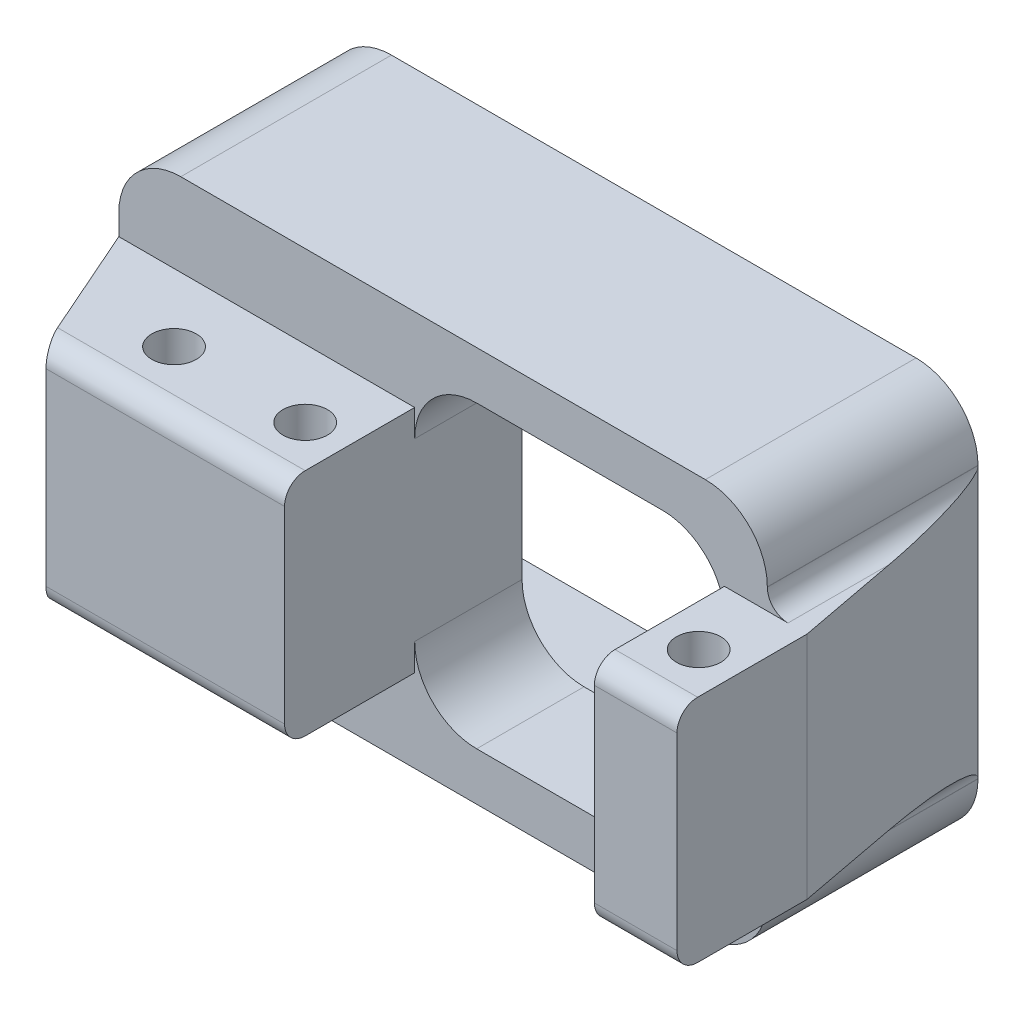
from build123d import *

# Parameters (mm, degrees)
SKETCH2_W           = 62.8
SKETCH2_H           = 38.3
SKETCH2_R           = 4.25
SKETCH2_W_2         = 30
SKETCH2_H_2         = 29
BOSS_EXTRUDE1_DEPTH = 10
SKETCH2_3_W         = 62.8
SKETCH2_3_H         = 38.3
SKETCH2_3_W_2       = 58
SKETCH2_3_H_2       = 33.5
BOSS_EXTRUDE2_DEPTH = 10
SKETCH2_4_R         = 6.5
CUT_EXTRUDE1_DEPTH  = 3
FILLET1_R           = 3.6
FILLET2_R           = 6
BOSS_EXTRUDE3_START = 0.4
SKETCH4_R           = 4.25
BOSS_EXTRUDE3_DEPTH = 0.4
SKETCH5_W           = 23.1
SKETCH5_H           = 22.25
SKETCH5_W_2         = 8
BOSS_EXTRUDE4_DEPTH = 12.6
SKETCH6_R           = 2.15
CUT_EXTRUDE2_DEPTH  = 22.25
BOSS_EXTRUDE6_DEPTH = 22.25
FILLET5_R           = 2
FILLET6_R           = 2
SKETCH4_2_R         = 4.25
CUT_EXTRUDE3_DEPTH  = 5
FILLET7_R           = 1


with BuildPart() as part:
    # Sketch2 → Boss-Extrude1 (new body)
    with BuildSketch(Plane.XY):
        with Locations((29, -16.75)):
            Rectangle(SKETCH2_W, SKETCH2_H)
        with Locations((16.2, -16.75)):
            Circle(SKETCH2_R, mode=Mode.SUBTRACT)
        with Locations((41.25, -16.75)):
            Rectangle(SKETCH2_W_2, SKETCH2_H_2, mode=Mode.SUBTRACT)
    extrude(amount=BOSS_EXTRUDE1_DEPTH)

    # Sketch2<3> → Boss-Extrude2 (add)
    with BuildSketch(Plane.XY):
        with Locations((29, -16.75)):
            Rectangle(SKETCH2_3_W, SKETCH2_3_H)
        with Locations((29, -16.75)):
            Rectangle(SKETCH2_3_W_2, SKETCH2_3_H_2, mode=Mode.SUBTRACT)
    extrude(amount=-BOSS_EXTRUDE2_DEPTH)

    # Sketch2<4> → Cut-Extrude1 (cut)
    with BuildSketch(Plane.XY):
        with Locations((14.45, -16.75)):
            Circle(SKETCH2_4_R)
    extrude(amount=CUT_EXTRUDE1_DEPTH, mode=Mode.SUBTRACT)

    # Fillet1
    fillet1_edges = [part.edges().sort_by_distance(p)[0] for p in [
        (58, 0, -5),
        (0, 0, -5),
        (0, -33.5, -5),
        (58, -33.5, -5),
    ]]
    fillet(fillet1_edges, radius=FILLET1_R)

    # Fillet2
    fillet2_edges = [part.edges().sort_by_distance(p)[0] for p in [
        (26.25, -2.25, 5),
        (26.25, -31.25, 5),
        (56.25, -31.25, 5),
        (56.25, -2.25, 5),
        (60.4, -35.9, 0),
        (-2.4, -35.9, 0),
        (-2.4, 2.4, 0),
        (60.4, 2.4, 0),
    ]]
    fillet(fillet2_edges, radius=FILLET2_R)

    # Sketch4 → Boss-Extrude3 (add)
    with BuildSketch(Plane.XY.offset(10).offset(BOSS_EXTRUDE3_START)):
        with BuildLine():
            Line((3.6, -35.9), (54.4, -35.9))
            ThreePointArc((54.4, -35.9), (58.642640687, -34.142640687), (60.4, -29.9))
            Line((60.4, -29.9), (60.4, -3.6))
            ThreePointArc((60.4, -3.6), (58.642640687, 0.642640687), (54.4, 2.4))
            Line((54.4, 2.4), (3.6, 2.4))
            ThreePointArc((3.6, 2.4), (-0.642640687, 0.642640687), (-2.4, -3.6))
            Line((-2.4, -3.6), (-2.4, -29.9))
            ThreePointArc((-2.4, -29.9), (-0.642640687, -34.142640687), (3.6, -35.9))
        make_face()
        with Locations((16.2, -16.75)):
            Circle(SKETCH4_R, mode=Mode.SUBTRACT)
        with BuildLine():
            Line((56.25, -8.25), (56.25, -25.25))
            ThreePointArc((56.25, -25.25), (54.492640687, -29.492640687), (50.25, -31.25))
            Line((50.25, -31.25), (32.25, -31.25))
            ThreePointArc((32.25, -31.25), (28.007359313, -29.492640687), (26.25, -25.25))
            Line((26.25, -25.25), (26.25, -8.25))
            ThreePointArc((26.25, -8.25), (28.007359313, -4.007359313), (32.25, -2.25))
            Line((32.25, -2.25), (50.25, -2.25))
            ThreePointArc((50.25, -2.25), (54.492640687, -4.007359313), (56.25, -8.25))
        make_face(mode=Mode.SUBTRACT)
    extrude(amount=-BOSS_EXTRUDE3_DEPTH)

    # Sketch5 → Boss-Extrude4 (add)
    with BuildSketch(Plane.XY.offset(10.4)):
        with Locations((14.7, -16.75)):
            Rectangle(SKETCH5_W, SKETCH5_H)
        with Locations((60.25, -16.75)):
            Rectangle(SKETCH5_W_2, SKETCH5_H)
    extrude(amount=BOSS_EXTRUDE4_DEPTH)

    # Sketch6 → Cut-Extrude2 (cut)
    with BuildSketch(Plane(origin=(0, -5.625, 0), x_dir=(1, 0, 0), z_dir=(0, 1, 0))):
        with Locations(Location((9.5, -16.95, 0), (0, 0, 270))):
            Circle(SKETCH6_R)
        with Locations(Location((22.2, -16.95, 0), (0, 0, 270))):
            Circle(SKETCH6_R)
        with Locations(Location((60.3, -16.95, 0), (0, 0, 270))):
            Circle(SKETCH6_R)
    extrude(amount=-CUT_EXTRUDE2_DEPTH, mode=Mode.SUBTRACT)

    # Sketch7 → Boss-Extrude6 (add)
    with BuildSketch(Plane(origin=(0, -5.625, 0), x_dir=(1, 0, 0), z_dir=(0, 1, 0))):
        Polygon((-2.4, -10.4), (3.15, -23), (3.15, -10.4), align=None)
        Polygon((60.4, -10.4), (64.25, -10.4), (60.4, 10), align=None)
    extrude(amount=-BOSS_EXTRUDE6_DEPTH)

    # Fillet5
    fillet5_edges = [part.edges().sort_by_distance(p)[0] for p in [
        (60.4, -27.875, 0.2),
        (60.4, -5.625, 0.2),
    ]]
    fillet(fillet5_edges, radius=FILLET5_R)

    # Fillet6
    fillet6_edges = [part.edges().sort_by_distance(p)[0] for p in [
        (60.25, -5.625, 23),
        (60.25, -27.875, 23),
        (14.7, -5.625, 23),
        (14.7, -27.875, 23),
    ]]
    fillet(fillet6_edges, radius=FILLET6_R)

    # Sketch4<2> → Cut-Extrude3 (cut)
    with BuildSketch(Plane.XY.offset(10)):
        with Locations((16.2, -16.75)):
            Circle(SKETCH4_2_R)
    extrude(amount=CUT_EXTRUDE3_DEPTH, mode=Mode.SUBTRACT)

    # Fillet7
    fillet7_edges = [part.edges().sort_by_distance(p)[0] for p in [
        (11.95, -16.75, 15),
    ]]
    fillet(fillet7_edges, radius=FILLET7_R)


solid = part.part
